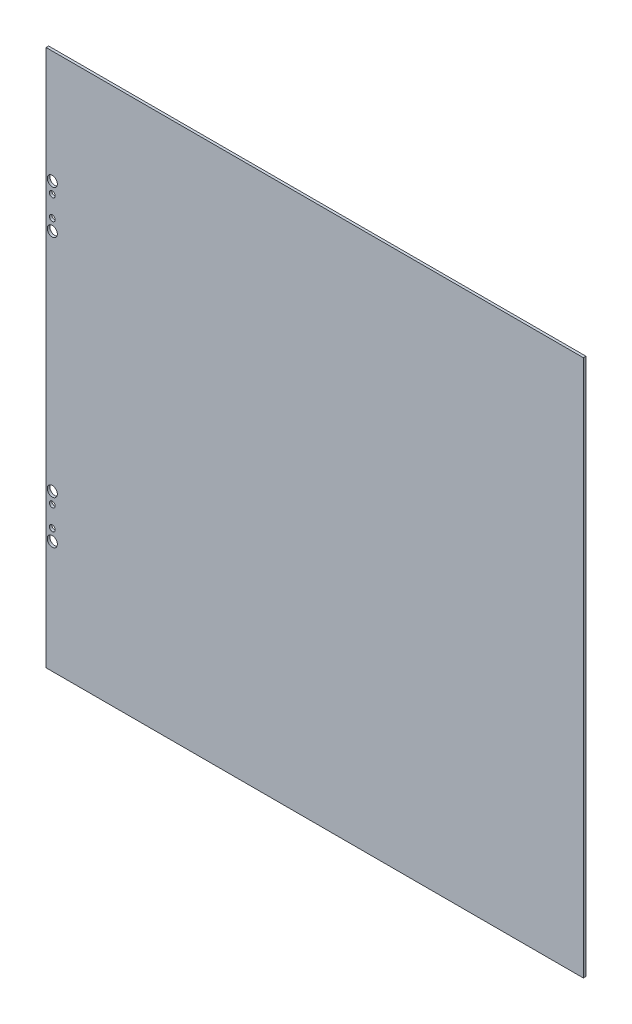
from build123d import *

# Parameters (mm, degrees)
SKETCH1_W           = 660.4
SKETCH1_H           = 660.4
SKETCH1_R           = 3.556
SKETCH1_R_2         = 6.1976
BOSS_EXTRUDE1_DEPTH = 3.175


with BuildPart() as part:
    # Sketch1 → Boss-Extrude1 (new body)
    with BuildSketch(Plane.XY):
        with Locations((330.2, 330.2)):
            Rectangle(SKETCH1_W, SKETCH1_H)
        with Locations((7.62, 508)):
            Circle(SKETCH1_R, mode=Mode.SUBTRACT)
        with Locations((7.62, 482.6)):
            Circle(SKETCH1_R, mode=Mode.SUBTRACT)
        with Locations((7.62, 177.8)):
            Circle(SKETCH1_R, mode=Mode.SUBTRACT)
        with Locations((7.62, 152.4)):
            Circle(SKETCH1_R, mode=Mode.SUBTRACT)
        with Locations((7.62, 521.97)):
            Circle(SKETCH1_R_2, mode=Mode.SUBTRACT)
        with Locations((7.62, 468.63)):
            Circle(SKETCH1_R_2, mode=Mode.SUBTRACT)
        with Locations((7.62, 191.77)):
            Circle(SKETCH1_R_2, mode=Mode.SUBTRACT)
        with Locations((7.62, 138.43)):
            Circle(SKETCH1_R_2, mode=Mode.SUBTRACT)
    extrude(amount=BOSS_EXTRUDE1_DEPTH)


solid = part.part
